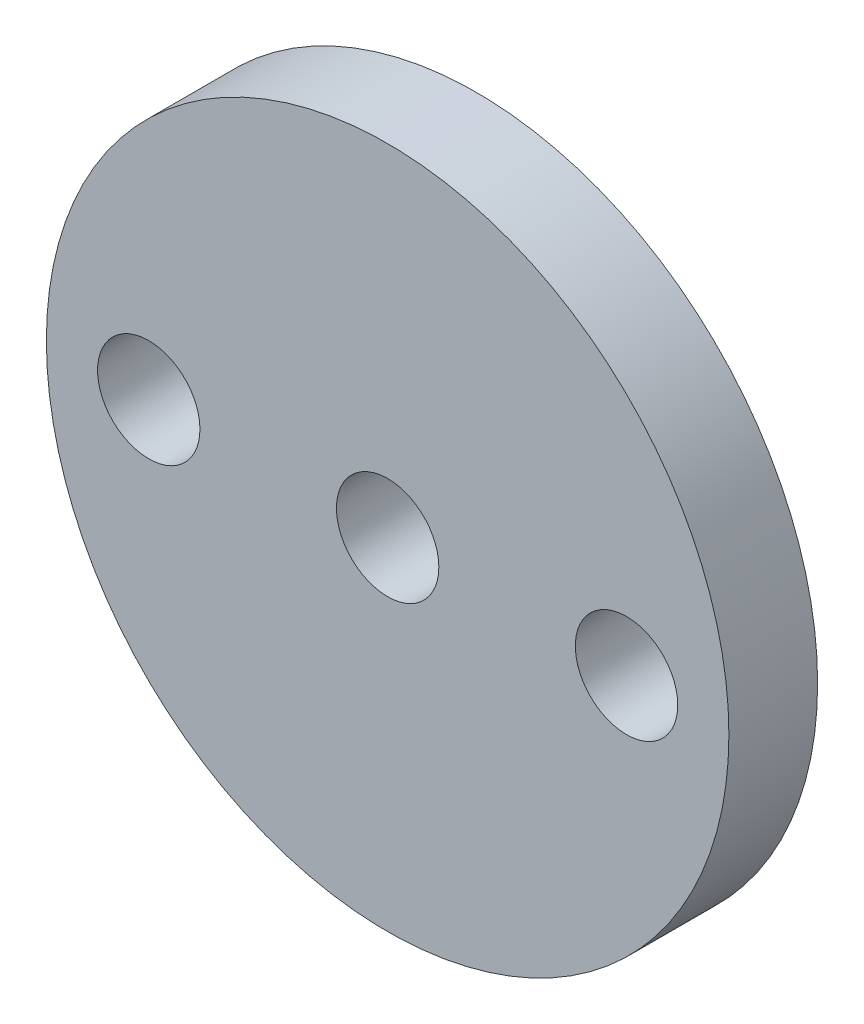
from build123d import *

# Parameters (mm, degrees)
SKETCH1_R           = 10
SKETCH1_R_2         = 1.5
BOSS_EXTRUDE1_DEPTH = 2.6


with BuildPart() as part:
    # Sketch1 → Boss-Extrude1 (new body)
    with BuildSketch(Plane.XY):
        Circle(SKETCH1_R)
        Circle(SKETCH1_R_2, mode=Mode.SUBTRACT)
        with Locations((7, 0)):
            Circle(SKETCH1_R_2, mode=Mode.SUBTRACT)
        with Locations((-7, 0)):
            Circle(SKETCH1_R_2, mode=Mode.SUBTRACT)
    extrude(amount=BOSS_EXTRUDE1_DEPTH)


solid = part.part
